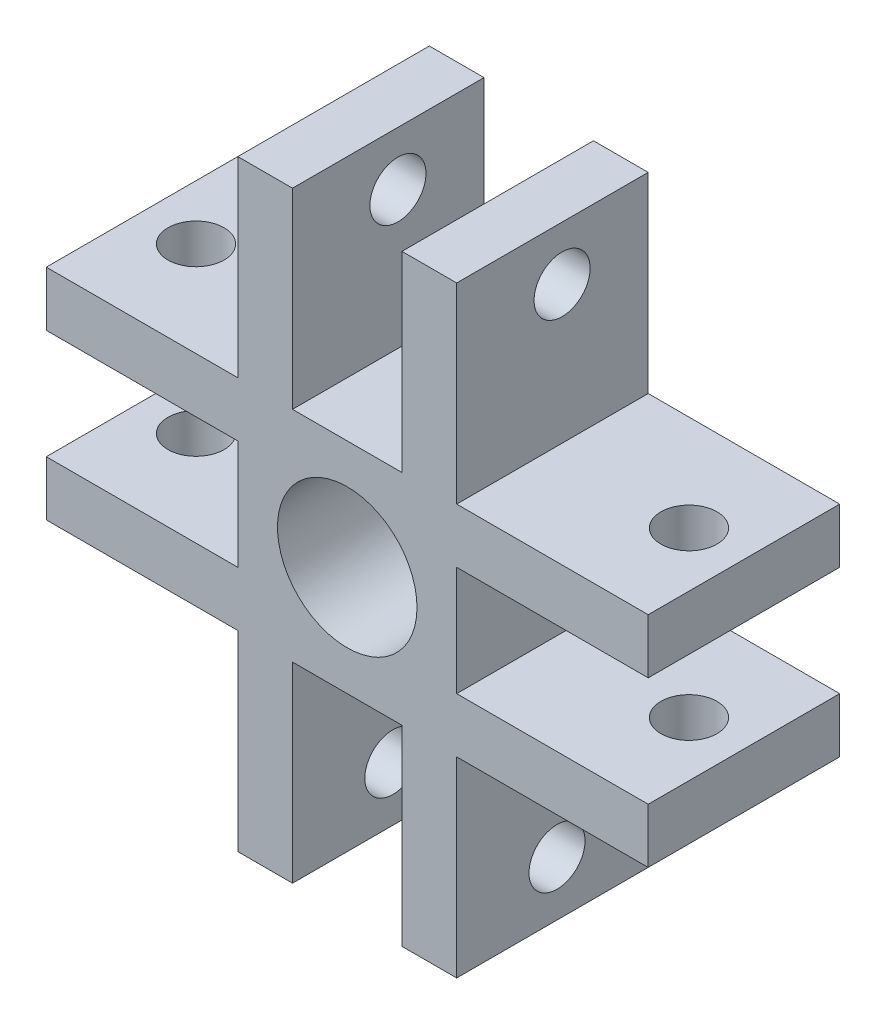
from build123d import *

# Parameters (mm, degrees)
SKETCH1_W       = 22
SKETCH1_H       = 22
EXTRUDE1_DEPTH  = 7
SKETCH2_W       = 7
SKETCH2_H       = 7
EXTRUDE2_DEPTH  = 7
SKETCH3_W       = 7
SKETCH3_H       = 4
SKETCH3_W_2     = 4
SKETCH3_H_2     = 7
EXTRUDE3_DEPTH  = 7
SKETCH4_W       = 4
SKETCH4_H       = 4
EXTRUDE5_DEPTH  = 7
SKETCH5_R       = 2.55
EXTRUDE6_DEPTH  = 10
SKETCH6_R       = 1.025
EXTRUDE7_DEPTH  = 10
SKETCH7_R       = 1.025
EXTRUDE8_DEPTH  = 10
SKETCH8_R       = 1.025
EXTRUDE9_DEPTH  = 10
SKETCH9_R       = 1.025
EXTRUDE10_DEPTH = 10


with BuildPart() as part:
    # Sketch1 → Extrude1 (new body)
    with BuildSketch(Plane.XY):
        Rectangle(SKETCH1_W, SKETCH1_H)
    extrude(amount=EXTRUDE1_DEPTH)

    # Sketch2 → Extrude2 (cut)
    with BuildSketch(Plane.XY.offset(7)):
        with Locations((7.5, 7.5)):
            Rectangle(SKETCH2_W, SKETCH2_H)
        with Locations((-7.5, 7.5)):
            Rectangle(SKETCH2_W, SKETCH2_H)
        with Locations((-7.5, -7.5)):
            Rectangle(SKETCH2_W, SKETCH2_H)
        with Locations((7.5, -7.5)):
            Rectangle(SKETCH2_W, SKETCH2_H)
    extrude(amount=-EXTRUDE2_DEPTH, mode=Mode.SUBTRACT)

    # Sketch3 → Extrude3 (cut)
    with BuildSketch(Plane.XY.offset(7)):
        with Locations((-7.5, 0)):
            Rectangle(SKETCH3_W, SKETCH3_H)
        with Locations((0, 7.5)):
            Rectangle(SKETCH3_W_2, SKETCH3_H_2)
        with Locations((7.5, 0)):
            Rectangle(SKETCH3_W, SKETCH3_H)
        with Locations((0, -7.5)):
            Rectangle(SKETCH3_W_2, SKETCH3_H_2)
        Rectangle(SKETCH3_W_2, SKETCH3_H)
    extrude(amount=-EXTRUDE3_DEPTH, mode=Mode.SUBTRACT)

    # Sketch4 → Extrude5 (add)
    with BuildSketch(Plane.XY.offset(7)):
        Rectangle(SKETCH4_W, SKETCH4_H)
    extrude(amount=-EXTRUDE5_DEPTH)

    # Sketch5 → Extrude6 (cut)
    with BuildSketch(Plane.XY.offset(7)):
        Circle(SKETCH5_R)
    extrude(amount=-EXTRUDE6_DEPTH, mode=Mode.SUBTRACT)

    # Sketch6 → Extrude7 (cut)
    with BuildSketch(Plane(origin=(4, 0, 0), x_dir=(0, 0, -1), z_dir=(1, 0, 0))):
        with Locations(Location((-3.14721043, 9.031360998, 0), (0, 0, 90))):
            Circle(SKETCH6_R)
    extrude(amount=-EXTRUDE7_DEPTH, mode=Mode.SUBTRACT)

    # Sketch7 → Extrude8 (cut)
    with BuildSketch(Plane.XZ.offset(4)):
        with Locations(Location((-9, 3.526976634, 0), (0, 0, 270))):
            Circle(SKETCH7_R)
    extrude(amount=-EXTRUDE8_DEPTH, mode=Mode.SUBTRACT)

    # Sketch8 → Extrude9 (cut)
    with BuildSketch(Plane(origin=(4, 0, 0), x_dir=(0, 0, -1), z_dir=(1, 0, 0))):
        with Locations((-3.332535344, -9)):
            Circle(SKETCH8_R)
    extrude(amount=-EXTRUDE9_DEPTH, mode=Mode.SUBTRACT)

    # Sketch9 → Extrude10 (cut)
    with BuildSketch(Plane(origin=(0, 4, 0), x_dir=(1, 0, 0), z_dir=(0, 1, 0))):
        with Locations(Location((9, -3.510451641, 0), (0, 0, 270))):
            Circle(SKETCH9_R)
    extrude(amount=-EXTRUDE10_DEPTH, mode=Mode.SUBTRACT)


solid = part.part
